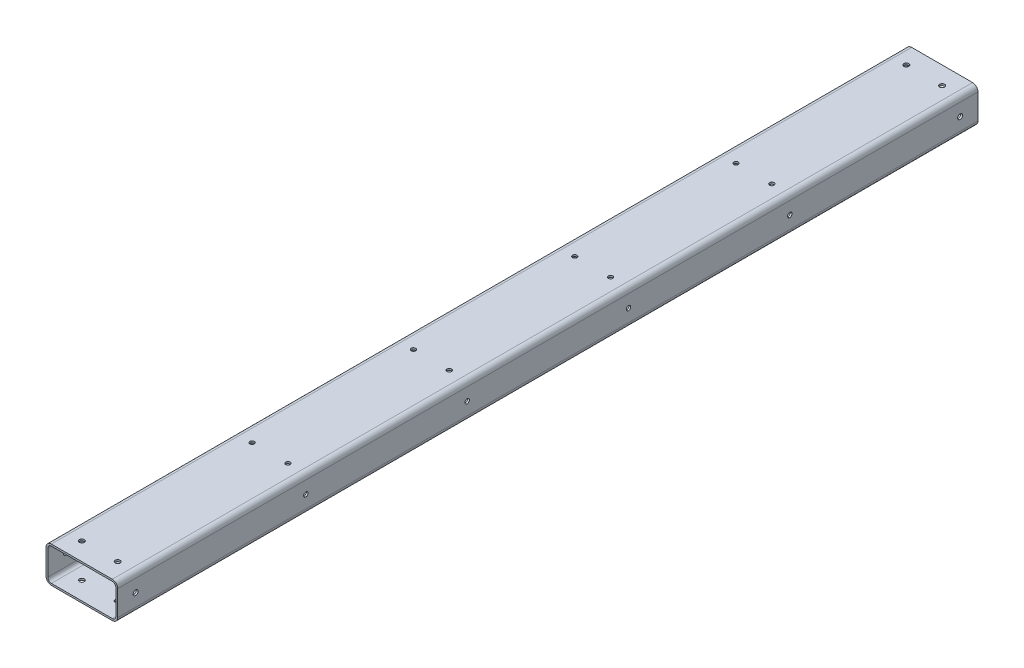
from build123d import *

# Parameters (mm, degrees)
AUFSATZ_LINEAR_AUSTRAGEN1_DEPTH = 480
SKIZZE2_R                       = 2.75
SCHNITT_LINEAR_AUSTRAGEN1_DEPTH = 100
SKIZZE3_R                       = 2.75
SCHNITT_LINEAR_AUSTRAGEN2_DEPTH = 100
SKIZZE4_R                       = 2.5
SCHNITT_LINEAR_AUSTRAGEN3_DEPTH = 100
SKIZZE5_R                       = 2.5
SCHNITT_LINEAR_AUSTRAGEN4_DEPTH = 100


with BuildPart() as part:
    # Skizze1 → Aufsatz-Linear austragen1 (new, symmetric)
    with BuildSketch(Plane.XY):
        with BuildLine():
            Line((-34, 20), (34, 20))
            ThreePointArc((34, 20), (38.242640687, 18.242640687), (40, 14))
            Line((40, 14), (40, -14))
            ThreePointArc((40, -14), (38.242640687, -18.242640687), (34, -20))
            Line((34, -20), (-34, -20))
            ThreePointArc((-34, -20), (-38.242640687, -18.242640687), (-40, -14))
            Line((-40, -14), (-40, 14))
            ThreePointArc((-40, 14), (-38.242640687, 18.242640687), (-34, 20))
        make_face()
        with BuildLine():
            Line((-38, 14), (-38, -14))
            ThreePointArc((-38, -14), (-36.828427125, -16.828427125), (-34, -18))
            Line((-34, -18), (34, -18))
            ThreePointArc((34, -18), (36.828427125, -16.828427125), (38, -14))
            Line((38, -14), (38, 14))
            ThreePointArc((38, 14), (36.828427125, 16.828427125), (34, 18))
            Line((34, 18), (-34, 18))
            ThreePointArc((-34, 18), (-36.828427125, 16.828427125), (-38, 14))
        make_face(mode=Mode.SUBTRACT)
    extrude(amount=AUFSATZ_LINEAR_AUSTRAGEN1_DEPTH, both=True)

    # Skizze2 → Schnitt-Linear austragen1 (cut)
    with BuildSketch(Plane(origin=(0, 20, 0), x_dir=(1, 0, 0), z_dir=(0, 1, 0))):
        with Locations(Location((20, 460, 0), (0, 0, 270))):
            Circle(SKIZZE2_R)
        with Locations((-20, 460)):
            Circle(SKIZZE2_R)
        with Locations((20, -460)):
            Circle(SKIZZE2_R)
        with Locations(Location((-20, -460, 0), (0, 0, 270))):
            Circle(SKIZZE2_R)
    extrude(amount=-SCHNITT_LINEAR_AUSTRAGEN1_DEPTH, mode=Mode.SUBTRACT)

    # Skizze3 → Schnitt-Linear austragen2 (cut)
    with BuildSketch(Plane(origin=(40, 0, 0), x_dir=(0, 0, -1), z_dir=(1, 0, 0))):
        with Locations((460, 0)):
            Circle(SKIZZE3_R)
        with Locations(Location((-460, 0, 0), (0, 0, 270))):
            Circle(SKIZZE3_R)
    extrude(amount=-SCHNITT_LINEAR_AUSTRAGEN2_DEPTH, mode=Mode.SUBTRACT)

    # Skizze4 → Schnitt-Linear austragen3 (cut)
    with BuildSketch(Plane(origin=(40, 0, 0), x_dir=(0, 0, -1), z_dir=(1, 0, 0))):
        with Locations((-270, 0)):
            Circle(SKIZZE4_R)
        with Locations((-90, 0)):
            Circle(SKIZZE4_R)
        with Locations(Location((90, 0, 0), (0, 0, 270))):
            Circle(SKIZZE4_R)
        with Locations(Location((270, 0, 0), (0, 0, 270))):
            Circle(SKIZZE4_R)
    extrude(amount=-SCHNITT_LINEAR_AUSTRAGEN3_DEPTH, mode=Mode.SUBTRACT)

    # Skizze5 → Schnitt-Linear austragen4 (cut)
    with BuildSketch(Plane(origin=(0, 20, 0), x_dir=(1, 0, 0), z_dir=(0, 1, 0))):
        with Locations(Location((20, 270, 0), (0, 0, 270))):
            Circle(SKIZZE5_R)
        with Locations(Location((20, 90, 0), (0, 0, 270))):
            Circle(SKIZZE5_R)
        with Locations((-20, 90)):
            Circle(SKIZZE5_R)
        with Locations((-20, 270)):
            Circle(SKIZZE5_R)
        with Locations((20, -90)):
            Circle(SKIZZE5_R)
        with Locations(Location((-20, -90, 0), (0, 0, 270))):
            Circle(SKIZZE5_R)
        with Locations((20, -270)):
            Circle(SKIZZE5_R)
        with Locations(Location((-20, -270, 0), (0, 0, 270))):
            Circle(SKIZZE5_R)
    extrude(amount=-SCHNITT_LINEAR_AUSTRAGEN4_DEPTH, mode=Mode.SUBTRACT)


solid = part.part
